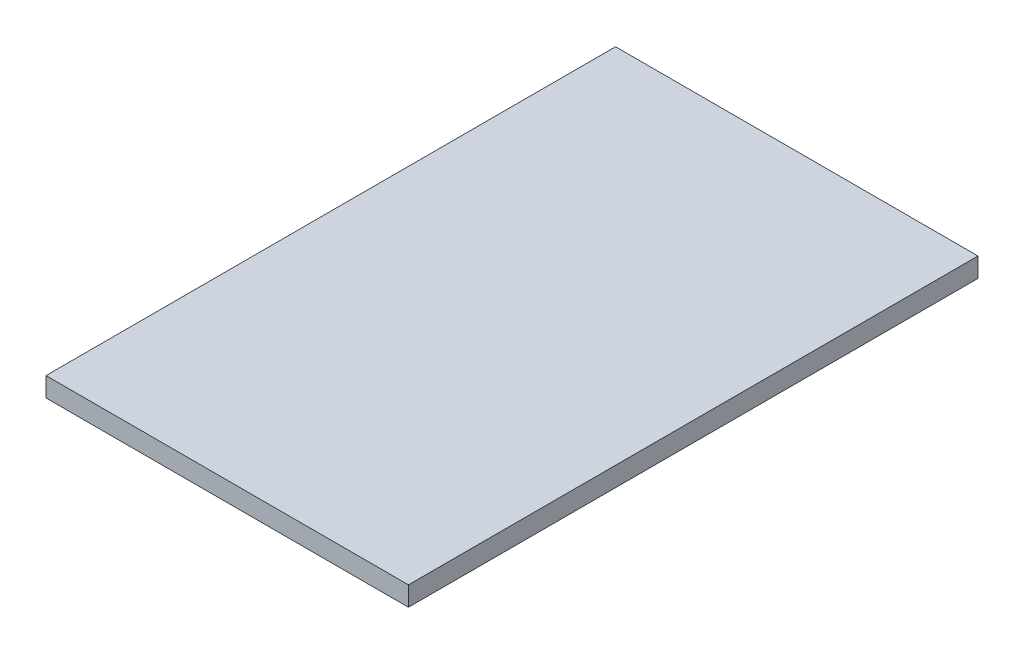
from build123d import *

# Parameters (mm, degrees)
ESQUISSE1_W        = 56
ESQUISSE1_H        = 88
BOSS_EXTRU_1_DEPTH = 3


with BuildPart() as part:
    # Esquisse1 → Boss.-Extru.1 (new body)
    with BuildSketch(Plane(origin=(0, 0, 0), x_dir=(1, 0, 0), z_dir=(0, 1, 0))):
        Rectangle(ESQUISSE1_W, ESQUISSE1_H)
    extrude(amount=BOSS_EXTRU_1_DEPTH)


solid = part.part
